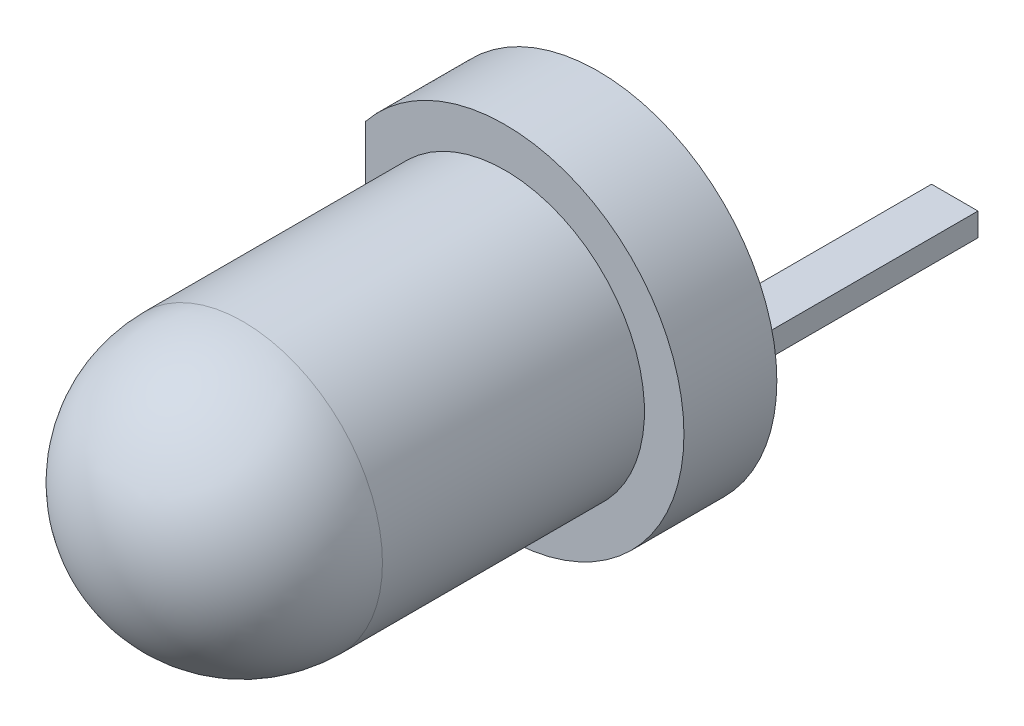
from build123d import *

# Parameters (mm, degrees)
ESBO_O1_R                = 1.5
RESSALTO_EXTRUS_O1_DEPTH = 5.32
FILETE1_R                = 1.5
RESSALTO_EXTRUS_O2_DEPTH = 1
ESBO_O3_W                = 0.5
ESBO_O3_H                = 0.25
RESSALTO_EXTRUS_O3_DEPTH = 2.54
ESBO_O4_W                = 0.93593998
ESBO_O4_H                = 0.492175334
CORTE_EXTRUS_O1_DEPTH    = 1


with BuildPart() as part:
    # Esboço1 → Ressalto-extrusão1 (new body)
    with BuildSketch(Plane.XY):
        Circle(ESBO_O1_R)
    extrude(amount=RESSALTO_EXTRUS_O1_DEPTH)

    # Filete1
    filete1_edges = [part.edges().sort_by_distance(p)[0] for p in [
        (-1.5, 0, 5.32),
    ]]
    fillet(filete1_edges, radius=FILETE1_R)

    # Esboço2 → Ressalto-extrusão2 (add)
    with BuildSketch(Plane(origin=(0, 0, 0), x_dir=(-1, 0, 0), z_dir=(0, 0, -1))):
        with BuildLine():
            Line((1.5, -1.206492851), (1.5, 1.206492851))
            ThreePointArc((1.5, 1.206492851), (-1.925, 0), (1.5, -1.206492851))
        make_face()
    extrude(amount=-RESSALTO_EXTRUS_O2_DEPTH)

    # Esboço3 → Ressalto-extrusão3 (add)
    with BuildSketch(Plane(origin=(0, 0, 0), x_dir=(-1, 0, 0), z_dir=(0, 0, -1))):
        with Locations((-1.3, 0)):
            Rectangle(ESBO_O3_W, ESBO_O3_H)
        with Locations((1.24, 0)):
            Rectangle(ESBO_O3_W, ESBO_O3_H)
    extrude(amount=RESSALTO_EXTRUS_O3_DEPTH)

    # Esboço4 → Corte-extrusão1 (cut)
    with BuildSketch(Plane(origin=(0, 0, -2.54), x_dir=(-1, 0, 0), z_dir=(0, 0, -1))):
        with Locations((1.231752211, 0.012102672)):
            Rectangle(ESBO_O4_W, ESBO_O4_H)
    extrude(amount=-CORTE_EXTRUS_O1_DEPTH, mode=Mode.SUBTRACT)


solid = part.part
